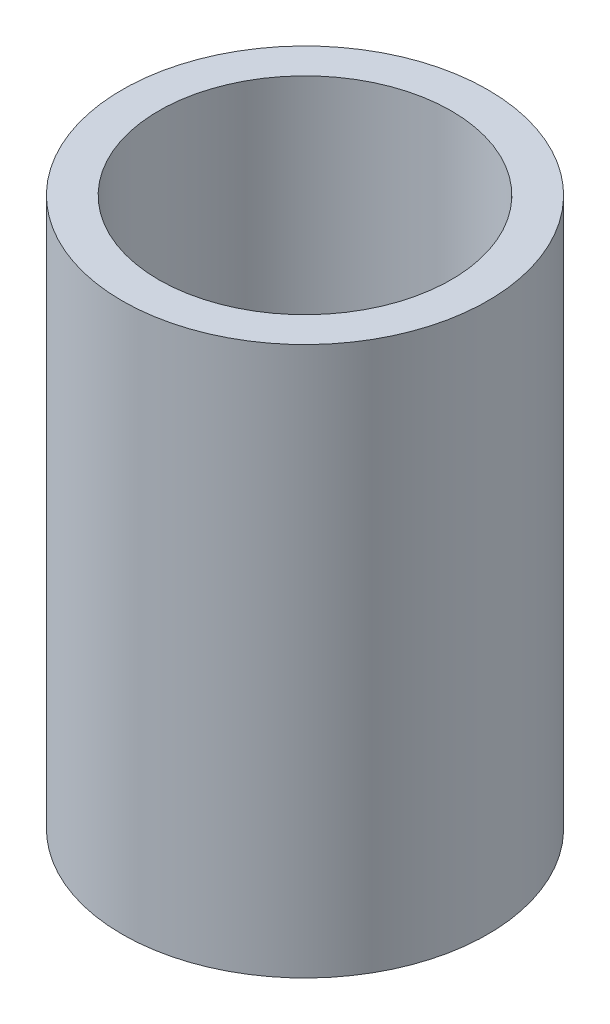
from build123d import *

# Parameters (mm, degrees)
SKETCH2_R           = 5
BOSS_EXTRUDE1_DEPTH = 15
SKETCH3_R           = 4
CUT_EXTRUDE1_DEPTH  = 13


with BuildPart() as part:
    # Sketch2 → Boss-Extrude1 (new body)
    with BuildSketch(Plane(origin=(0, 0, 0), x_dir=(1, 0, 0), z_dir=(0, 1, 0))):
        with Locations(Location((0, 0, 0), (0, 0, 270))):
            Circle(SKETCH2_R)
    extrude(amount=BOSS_EXTRUDE1_DEPTH)

    # Sketch3 → Cut-Extrude1 (cut)
    with BuildSketch(Plane(origin=(0, 15, 0), x_dir=(1, 0, 0), z_dir=(0, 1, 0))):
        with Locations(Location((0, 0, 0), (0, 0, 270))):
            Circle(SKETCH3_R)
    extrude(amount=-CUT_EXTRUDE1_DEPTH, mode=Mode.SUBTRACT)


solid = part.part
